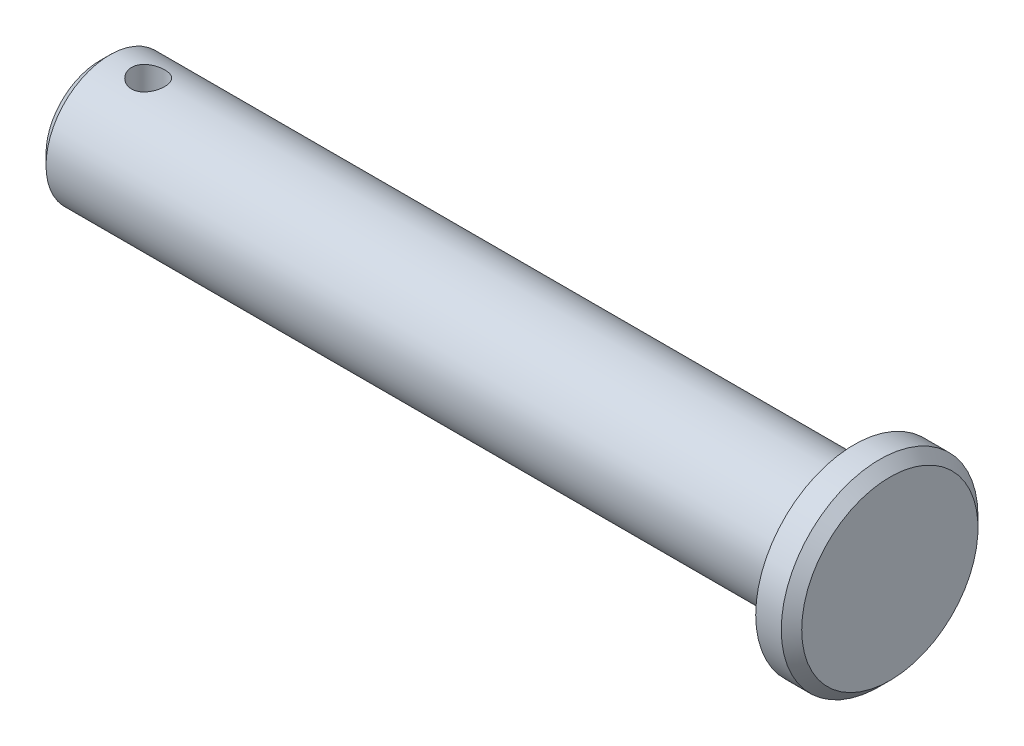
from build123d import *

# Parameters (mm, degrees)
CORTE_EXTRUS_O1_DEPTH      = 82.967885327
CORTE_EXTRUS_O1_DEPTH_BACK = 82.967885327
ESBO_O2_R                  = 3.25


with BuildPart() as part:
    # Esboço1 → Revolução1 (revolve)
    with BuildSketch(Plane.XY, mode=Mode.PRIVATE) as revolu_o1_sk:
        Polygon((77.315, 0), (77.315, 17.25), (75.315, 19.25), (70.315, 19.25), (70.315, 12.5), (-75.315, 12.5), (-77.315, 10.5), (-77.315, 0), align=None)
    revolve(revolu_o1_sk.sketch.rotate(Axis((-77.315, 0, 0), (1, 0, 0)), 90), axis=Axis((-77.315, 0, 0), (1, 0, 0)))

    # Esboço2 → Corte-extrusão1 (cut, two sides: drawn at the far end of the back side and taken through both)
    with BuildSketch(Plane(origin=(0, 0, 0), x_dir=(1, 0, 0), z_dir=(0, 1, 0)).offset(-CORTE_EXTRUS_O1_DEPTH_BACK)):
        with Locations(Location((-67.815, 0, 0), (0, 0, 270))):
            Circle(ESBO_O2_R)
    extrude(amount=CORTE_EXTRUS_O1_DEPTH + CORTE_EXTRUS_O1_DEPTH_BACK, mode=Mode.SUBTRACT)


solid = part.part
